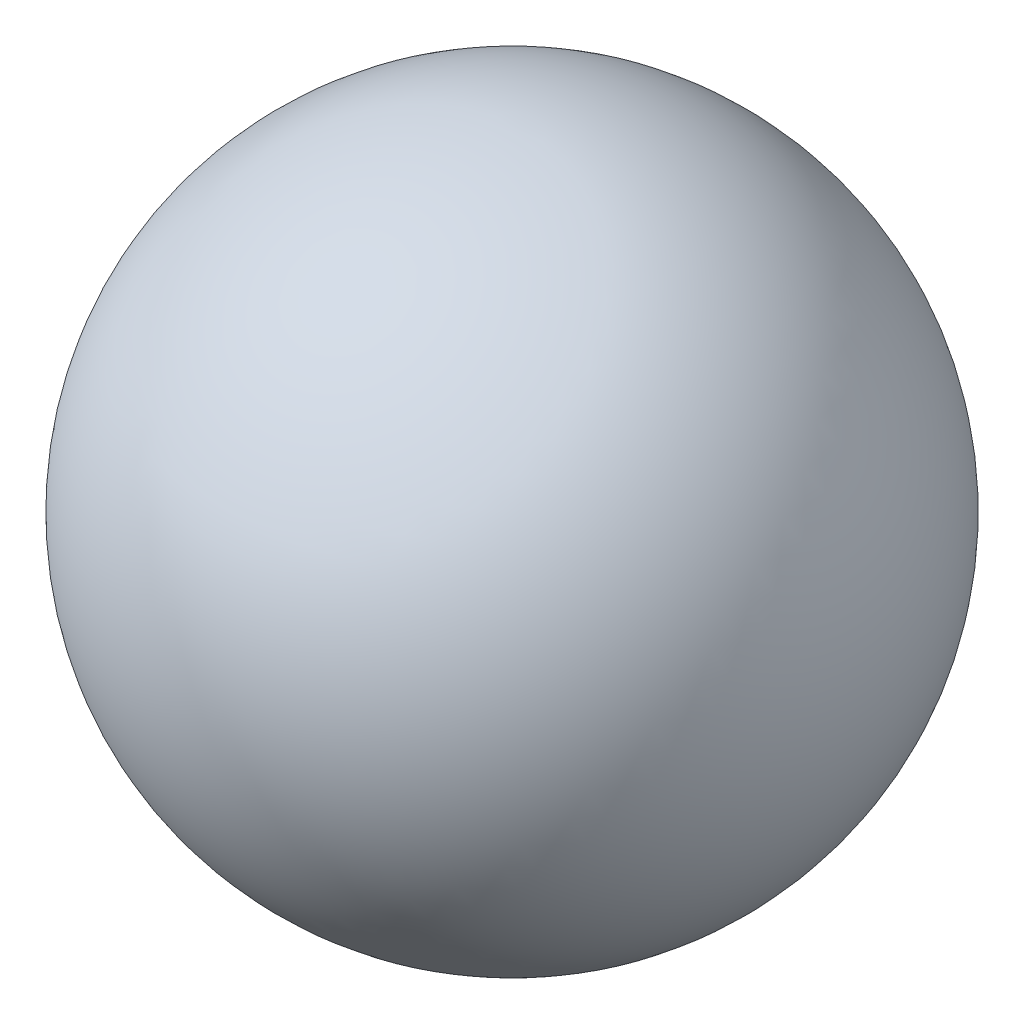
from build123d import *


with BuildPart() as part:
    # Эскиз7 → Шарик 14мм (revolve)
    with BuildSketch(Plane.XY):
        with BuildLine():
            Line((0, 7), (0, -7))
            ThreePointArc((0, -7), (7, 0), (0, 7))
        make_face()
    revolve(axis=Axis((0, 7, 0), (0, -1, 0)))


solid = part.part
